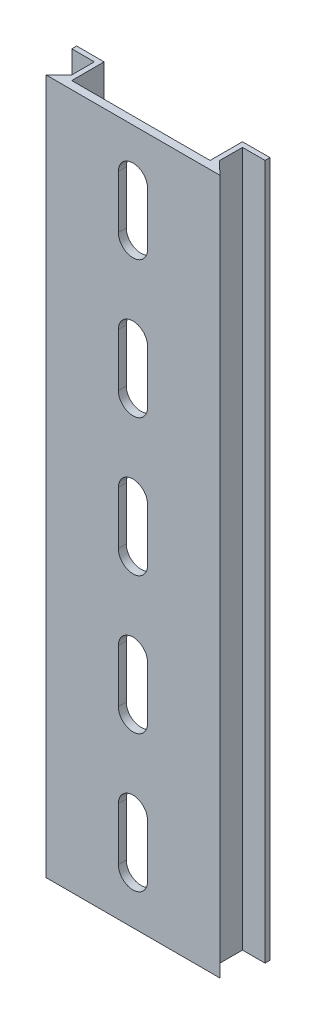
from build123d import *

# Parameters (mm, degrees)
BOSS_EXTRUDE1_DEPTH = 63.5
CUT_EXTRUDE1_DEPTH  = 67.318446642
LPATTERN1_COUNT     = 3
LPATTERN1_PITCH     = 25
LPATTERN1_COL_COUNT = 3
LPATTERN1_COL_PITCH = 25


with BuildPart() as part:
    # Sketch1 → Boss-Extrude1 (new, symmetric)
    with BuildSketch(Plane(origin=(0, 0, 0), x_dir=(1, 0, 0), z_dir=(0, 1, 0))):
        Polygon((-15.875, 0), (0, 0), (0, 1.4478), (-12.6365, 1.4478), (-12.6365, 7.366), (-17.653, 7.366), (-17.653, 6.477), (-13.5255, 6.477), (-13.5255, 2.286), align=None)
        Polygon((0, 1.4478), (0, 0), (15.875, 0), (13.5255, 2.286), (13.5255, 6.477), (17.653, 6.477), (17.653, 7.366), (12.6365, 7.366), (12.6365, 1.4478), align=None)
    extrude(amount=BOSS_EXTRUDE1_DEPTH, both=True)

    # Sketch2 → Cut-Extrude1 (cut, through all)
    with BuildSketch(Plane.XY):
        with BuildLine():
            Line((-2.667, -4.833), (-2.667, 4.833))
            ThreePointArc((-2.667, 4.833), (0, 7.5), (2.667, 4.833))
            Line((2.667, 4.833), (2.667, -4.833))
            ThreePointArc((2.667, -4.833), (0, -7.5), (-2.667, -4.833))
        make_face()
    cut_extrude1 = extrude(amount=-CUT_EXTRUDE1_DEPTH, mode=Mode.SUBTRACT)

    # LPattern1: Cut-Extrude1 ×3
    with Locations(*[(0, -i * LPATTERN1_PITCH, 0) for i in range(1, LPATTERN1_COUNT)]):
        add(cut_extrude1, mode=Mode.SUBTRACT)

    # LPattern1 col: Cut-Extrude1 ×3
    with Locations(*[(0, i * LPATTERN1_COL_PITCH, 0) for i in range(1, LPATTERN1_COL_COUNT)]):
        add(cut_extrude1, mode=Mode.SUBTRACT)


solid = part.part
